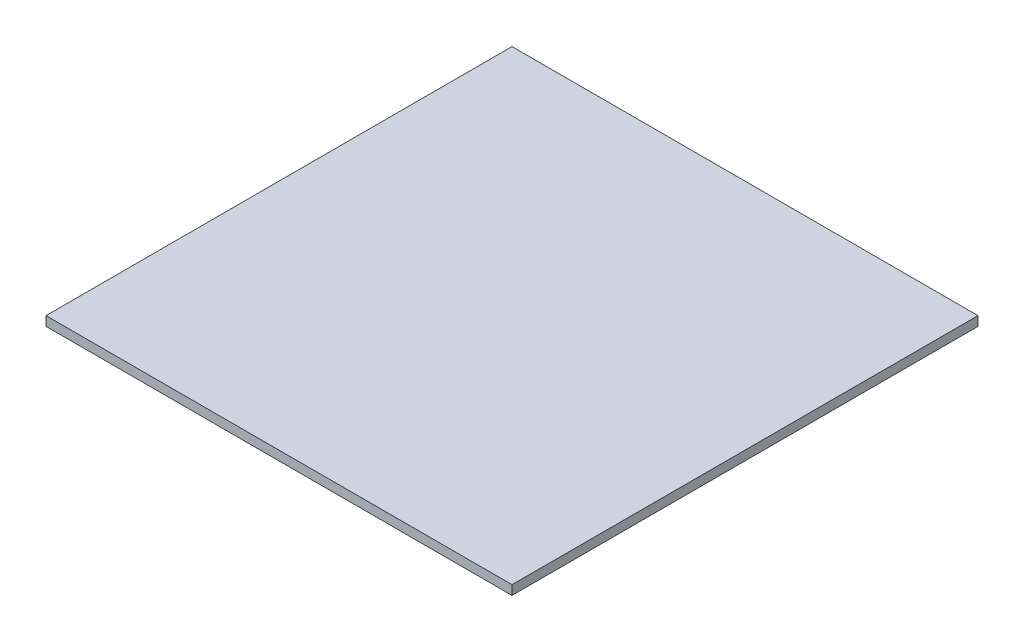
from build123d import *

# Parameters (mm, degrees)
ESBO_O2_W                = 500
ESBO_O2_H                = 500
RESSALTO_EXTRUS_O1_DEPTH = 10


with BuildPart() as part:
    # Esboço2 → Ressalto-extrusão1 (new body)
    with BuildSketch(Plane(origin=(0, 0, 0), x_dir=(1, 0, 0), z_dir=(0, 1, 0))):
        with Locations((250, 250)):
            Rectangle(ESBO_O2_W, ESBO_O2_H)
    extrude(amount=RESSALTO_EXTRUS_O1_DEPTH)


solid = part.part
